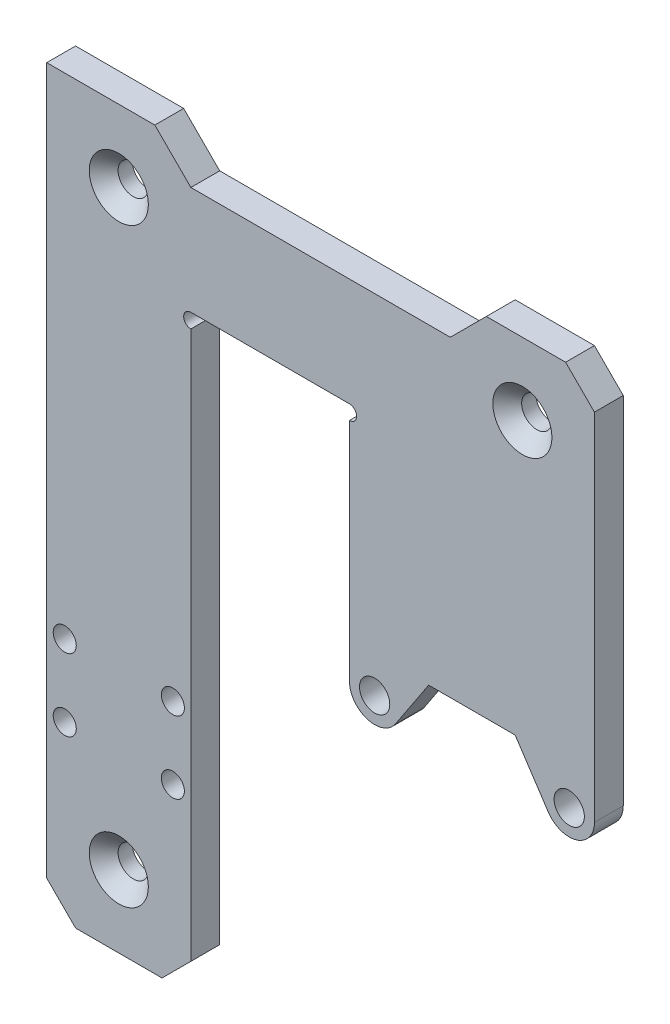
from build123d import *

# Parameters (mm, degrees)
SKETCH_1_R          = 2.1
EXTRUDE_1_DEPTH     = 2
CUT_EXTRUDE_1_DEPTH = 94.621578709
CHAMFER_1_SIZE      = 2
SKETCH_4_R          = 1
CUT_EXTRUDE_2_DEPTH = 94.621578709
CHAMFER_2_SIZE      = 4
SKETCH_7_R          = 1.6
CUT_EXTRUDE_3_DEPTH = 94.621578709


with BuildPart() as part:
    # 草图1 → 凸台-拉伸1 (new, symmetric)
    with BuildSketch(Plane.XY):
        with BuildLine():
            Line((11, 0), (-11, 0))
            Line((-11, 0), (-11, -82))
            Line((-11, -82), (-31, -82))
            Line((-31, -82), (-31, 20))
            Line((-31, 20), (45, 20))
            Line((45, 20), (45, -33.306562209))
            ThreePointArc((45, -33.306562209), (42.507569164, -36.65839818), (38.580111783, -35.236394534))
            Line((38.580111783, -35.236394534), (34, -28.306562209))
            Line((34, -28.306562209), (22, -28.306562209))
            Line((22, -28.306562209), (17.419888217, -35.236394534))
            ThreePointArc((17.419888217, -35.236394534), (13.492430836, -36.65839818), (11, -33.306562209))
            Line((11, -33.306562209), (11, 0))
        make_face()
        with Locations((-21, 10)):
            Circle(SKETCH_1_R, mode=Mode.SUBTRACT)
        with Locations((35, 10)):
            Circle(SKETCH_1_R, mode=Mode.SUBTRACT)
        with Locations((14.5, -33.306562209)):
            Circle(SKETCH_1_R, mode=Mode.SUBTRACT)
        with Locations((41.5, -33.306562209)):
            Circle(SKETCH_1_R, mode=Mode.SUBTRACT)
        with Locations((-21, -72)):
            Circle(SKETCH_1_R, mode=Mode.SUBTRACT)
    extrude(amount=EXTRUDE_1_DEPTH, both=True)

    # 草图3 → 切除-拉伸1 (cut, through all)
    with BuildSketch(Plane.XY.offset(2)):
        Polygon((-16, 20), (-11, 15), (25, 15), (30, 20), align=None)
    extrude(amount=-CUT_EXTRUDE_1_DEPTH, mode=Mode.SUBTRACT)

    # 倒角1
    chamfer_1_edges = [part.edges().sort_by_distance(p)[0] for p in [
        (-23.1, 10, 2),
        (32.9, 10, 2),
        (-23.1, -72, 2),
    ]]
    chamfer(chamfer_1_edges, length=CHAMFER_1_SIZE)

    # 草图4 → 切除-拉伸2 (cut, through all)
    with BuildSketch(Plane.XY.offset(2)):
        with Locations((-11, -1)):
            Circle(SKETCH_4_R)
        with Locations((11, -1)):
            Circle(SKETCH_4_R)
    extrude(amount=-CUT_EXTRUDE_2_DEPTH, mode=Mode.SUBTRACT)

    # 倒角2
    chamfer_2_edges = [part.edges().sort_by_distance(p)[0] for p in [
        (-11, -82, 0),
        (-31, -82, 0),
        (45, 20, 0),
    ]]
    chamfer(chamfer_2_edges, length=CHAMFER_2_SIZE)

    # 草图7 → 切除-拉伸3 (cut, through all)
    with BuildSketch(Plane.XY.offset(2)):
        with Locations((-28.5, -48)):
            Circle(SKETCH_7_R)
        with Locations((-28.5, -58)):
            Circle(SKETCH_7_R)
        with Locations((-13.5, -48)):
            Circle(SKETCH_7_R)
        with Locations((-13.5, -58)):
            Circle(SKETCH_7_R)
    extrude(amount=-CUT_EXTRUDE_3_DEPTH, mode=Mode.SUBTRACT)


solid = part.part
